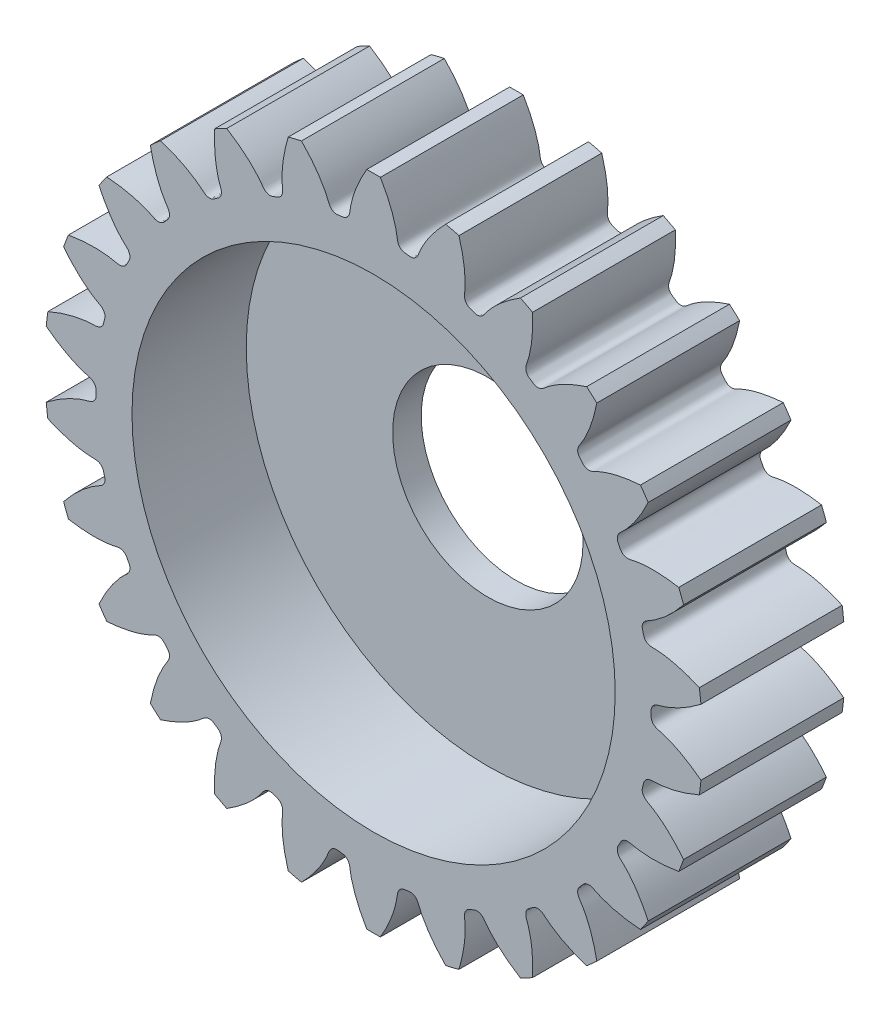
from build123d import *

# Parameters (mm, degrees)
SKETCHREVOLVESPURASSEMBLYNEW2PINION_W       = 6
SKETCHREVOLVESPURASSEMBLYNEW2PINION_H       = 13.822115385
TOOTHEXTRUDECUTSPURASSEMBLYNEW2PINION_DEPTH = 4
PATTERNSPURASSEMBLYNEW2PINION_COUNT         = 26
SKETCH_2_R                                  = 10.15
CUT_EXTRUDE_2_DEPTH                         = 4.8
SKETCH_4_R                                  = 4
CUT_EXTRUDE_3_DEPTH                         = 21.080697223


with BuildPart() as part:
    # SketchRevolveSpurAssemblyNew2Pinion → SpurAssemblyNew2Pinion (revolve)
    with BuildSketch(Plane(origin=(0, 0, 0), x_dir=(0, 0, -1), z_dir=(1, 0, 0))):
        with Locations((-1, 6.911057693)):
            Rectangle(SKETCHREVOLVESPURASSEMBLYNEW2PINION_W, SKETCHREVOLVESPURASSEMBLYNEW2PINION_H)
    revolve(axis=Axis((0, 0, 0), (0, 0, -1)))

    # SketchToothSpurAssemblyNew2Pinion → ToothExtrudeCutSpurAssemblyNew2Pinion (cut, symmetric)
    with BuildSketch(Plane.XY):
        with BuildLine():
            ThreePointArc((13.81451757, 1.428912571), (13.888221154, 0), (13.81451757, -1.428912571))
            add(Edge.make_bspline(
                [(13.81451757, -1.428912571), (13.726688541, -1.359920515), (13.595197672, -1.261341012), (13.418856258, -1.138772461), (13.292585484, -1.055332348), (13.169877801, -0.978321954), (13.050962499, -0.907526114), (12.936060688, -0.842722426), (12.825385077, -0.783681639), (12.719139799, -0.730167838), (12.617520148, -0.681938938), (12.520712627, -0.638746252), (12.428893992, -0.600337203), (12.342233738, -0.566447419), (12.260885006, -0.536828638), (12.185014321, -0.511156667), (12.114702314, -0.489338003), (12.027112004, -0.463735243), (11.954138744, -0.448230597), (11.897794168, -0.427981043), (11.875856753, -0.418994985), (11.853410983, -0.408473503), (11.830202837, -0.395946023), (11.805975271, -0.380738879), (11.780539315, -0.361904625), (11.753919073, -0.33815527), (11.726633215, -0.307873546), (11.700089703, -0.269352659), (11.677071777, -0.221496801), (11.661562379, -0.16645758), (11.656168867, -0.09130535), (11.660269272, 0), (11.656168867, 0.09130535), (11.661562379, 0.16645758), (11.677071777, 0.221496801), (11.700089703, 0.269352659), (11.726633215, 0.307873546), (11.753919073, 0.33815527), (11.780539315, 0.361904625), (11.805975271, 0.380738879), (11.830202837, 0.395946023), (11.853410983, 0.408473503), (11.875856753, 0.418994985), (11.897794168, 0.427981043), (11.954138744, 0.448230597), (12.027112004, 0.463735243), (12.114702314, 0.489338003), (12.185014321, 0.511156667), (12.260885006, 0.536828638), (12.342233738, 0.566447419), (12.428893992, 0.600337203), (12.520712627, 0.638746252), (12.617520148, 0.681938938), (12.719139799, 0.730167838), (12.825385077, 0.783681639), (12.936060688, 0.842722426), (13.050962499, 0.907526114), (13.169877801, 0.978321954), (13.292585484, 1.055332348), (13.418856258, 1.138772461), (13.595197672, 1.261341012), (13.726688541, 1.359920515), (13.81451757, 1.428912571)],
                knots=[0, 0, 0, 0, 0.061765594, 0.090857399, 0.118755208, 0.145459022, 0.170968841, 0.195284665, 0.218406493, 0.240334327, 0.261068165, 0.280608009, 0.298953857, 0.31610571, 0.332063567, 0.34682743, 0.360397297, 0.37277317, 0.397298679, 0.401522405, 0.405867911, 0.410405301, 0.415225201, 0.420444455, 0.426211586, 0.432708636, 0.440141309, 0.448702283, 0.458489871, 0.469387514, 0.480099546, 0.5, 0.519900454, 0.530612486, 0.541510129, 0.551297717, 0.559858691, 0.567291364, 0.573788414, 0.579555545, 0.584774799, 0.589594699, 0.594132089, 0.598477595, 0.602701321, 0.62722683, 0.639602703, 0.65317257, 0.667936433, 0.68389429, 0.701046143, 0.719391991, 0.738931835, 0.759665673, 0.781593507, 0.804715335, 0.829031159, 0.854540978, 0.881244792, 0.909142601, 0.938234406, 1, 1, 1, 1], degree=3))
        make_face()
    toothextrudecutspurassemblynew2pinion = extrude(amount=TOOTHEXTRUDECUTSPURASSEMBLYNEW2PINION_DEPTH, both=True, mode=Mode.SUBTRACT)

    # PatternSpurAssemblyNew2Pinion: ToothExtrudeCutSpurAssemblyNew2Pinion ×26 about axis
    patternspurassemblynew2pinion_axis = Axis((0, 0, 50), (0, 0, -1))
    for i in range(1, PATTERNSPURASSEMBLYNEW2PINION_COUNT):
        add(toothextrudecutspurassemblynew2pinion.rotate(patternspurassemblynew2pinion_axis, i * 360 / PATTERNSPURASSEMBLYNEW2PINION_COUNT), mode=Mode.SUBTRACT)

    # Эскиз2 → Вырез-Вытянуть2 (cut)
    with BuildSketch(Plane.XY.offset(4)):
        Circle(SKETCH_2_R)
    extrude(amount=-CUT_EXTRUDE_2_DEPTH, mode=Mode.SUBTRACT)

    # Эскиз4 → Вырез-Вытянуть3 (cut, through all)
    with BuildSketch(Plane.XY.offset(-0.8)):
        Circle(SKETCH_4_R)
    extrude(amount=-CUT_EXTRUDE_3_DEPTH, mode=Mode.SUBTRACT)


solid = part.part
